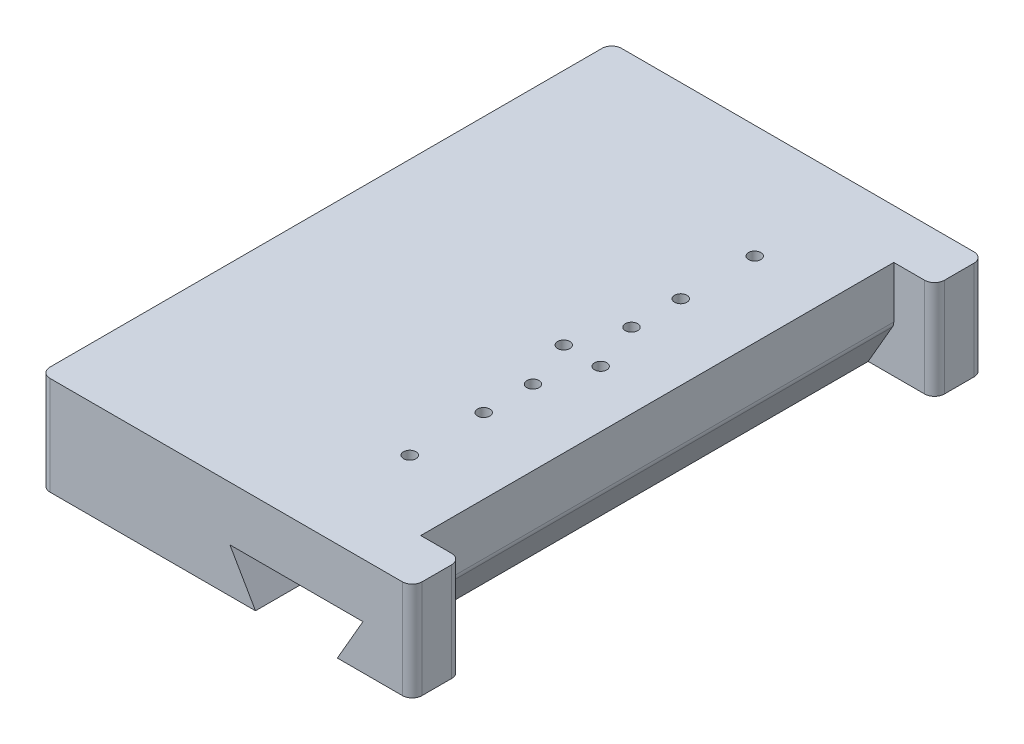
from build123d import *

# Parameters (mm, degrees)
SKETCH1_W           = 100
SKETCH1_H           = 116
SKETCH1_R           = 2.2
BOSS_EXTRUDE2_DEPTH = 20
FILLET2_R           = 2
CUT_EXTRUDE7_DEPTH  = 155.45387661
SKETCH22_R          = 1.25
CUT_EXTRUDE12_DEPTH = 118.320075008
CUT_EXTRUDE13_START = -10
CUT_EXTRUDE13_DEPTH = 96
SKETCH26_W          = 24.5
SKETCH26_H          = 20
CUT_EXTRUDE14_DEPTH = 155.45387661
FILLET11_R          = 2


with BuildPart() as part:
    # Sketch1 → Boss-Extrude2 (new body)
    # profile 1 of 5: a face of its own
    with BuildSketch(Plane(origin=(0, 0, 0), x_dir=(1, 0, 0), z_dir=(0, 1, 0))):
        with Locations((50, 0)):
            Rectangle(SKETCH1_W, SKETCH1_H)
        with Locations((97.5, 35)):
            Circle(SKETCH1_R, mode=Mode.SUBTRACT)
        with Locations((97.5, -35)):
            Circle(SKETCH1_R, mode=Mode.SUBTRACT)
        with Locations((75, 35)):
            Circle(SKETCH1_R, mode=Mode.SUBTRACT)
        with Locations((75, -35)):
            Circle(SKETCH1_R, mode=Mode.SUBTRACT)
    # profile 2 of 5: a face of its own
    with BuildSketch(Plane(origin=(0, 0, 0), x_dir=(1, 0, 0), z_dir=(0, 1, 0))):
        with Locations((75, -35)):
            Circle(SKETCH1_R)
    # profile 3 of 5: a face of its own
    with BuildSketch(Plane(origin=(0, 0, 0), x_dir=(1, 0, 0), z_dir=(0, 1, 0))):
        with Locations((97.5, -35)):
            Circle(SKETCH1_R)
    # profile 4 of 5: a face of its own
    with BuildSketch(Plane(origin=(0, 0, 0), x_dir=(1, 0, 0), z_dir=(0, 1, 0))):
        with Locations((75, 35)):
            Circle(SKETCH1_R)
    # profile 5 of 5: a face of its own
    with BuildSketch(Plane(origin=(0, 0, 0), x_dir=(1, 0, 0), z_dir=(0, 1, 0))):
        with Locations((97.5, 35)):
            Circle(SKETCH1_R)
    extrude(amount=-BOSS_EXTRUDE2_DEPTH)

    # Fillet2
    fillet2_edges = [part.edges().sort_by_distance(p)[0] for p in [
        (100, -10, -58),
        (100, -10, 58),
        (0, -10, 58),
        (0, -10, -58),
    ]]
    fillet(fillet2_edges, radius=FILLET2_R)

    # Sketch8 → Cut-Extrude7 (cut, through all)
    with BuildSketch(Plane.XY.offset(58)):
        Polygon((38.788675135, -11), (44.562177826, -11), (59.437822174, -11), (65.211324865, -11), (65.5, -11), (59.437822174, -21.5), (44.562177826, -21.5), (38.5, -11), align=None)
    extrude(amount=-CUT_EXTRUDE7_DEPTH, mode=Mode.SUBTRACT)

    # Sketch22 → Cut-Extrude12 (cut, through all)
    with BuildSketch(Plane(origin=(0, 0, 0), x_dir=(1, 0, 0), z_dir=(0, 1, 0))):
        with Locations(Location((48.25, 0, 0), (0, 0, 270))):
            Circle(SKETCH22_R)
        with Locations(Location((55.75, 0, 0), (0, 0, 270))):
            Circle(SKETCH22_R)
        with Locations(Location((52, 10, 0), (0, 0, 270))):
            Circle(SKETCH22_R)
        with Locations(Location((52, 20, 0), (0, 0, 270))):
            Circle(SKETCH22_R)
        with Locations(Location((52, 35, 0), (0, 0, 270))):
            Circle(SKETCH22_R)
        with Locations(Location((52, -35, 0), (0, 0, 180))):
            Circle(SKETCH22_R)
        with Locations(Location((52, -20, 0), (0, 0, 180))):
            Circle(SKETCH22_R)
        with Locations(Location((52, -10, 0), (0, 0, 180))):
            Circle(SKETCH22_R)
    extrude(amount=-CUT_EXTRUDE12_DEPTH, mode=Mode.SUBTRACT)

    # Sketch24 → Cut-Extrude13 (cut)
    with BuildSketch(Plane(origin=(0, 0, -58), x_dir=(-1, 0, 0), z_dir=(0, 0, -1)).offset(CUT_EXTRUDE13_START)):
        Polygon((-62.035898385, -20), (-67.232050808, -11), (-67.232050808, 0), (-100, 0), (-100, -20), align=None)
    extrude(amount=-CUT_EXTRUDE13_DEPTH, mode=Mode.SUBTRACT)

    # Sketch26 → Cut-Extrude14 (cut, through all)
    with BuildSketch(Plane.XY.offset(58)):
        with Locations((87.75, -10)):
            Rectangle(SKETCH26_W, SKETCH26_H)
    extrude(amount=-CUT_EXTRUDE14_DEPTH, mode=Mode.SUBTRACT)

    # Fillet11
    fillet11_edges = [part.edges().sort_by_distance(p)[0] for p in [
        (67.232050808, -11, 0),
        (75.5, -10, 48),
        (75.5, -10, 58),
        (75.5, -10, -48),
        (75.5, -10, -58),
    ]]
    fillet(fillet11_edges, radius=FILLET11_R)


solid = part.part
